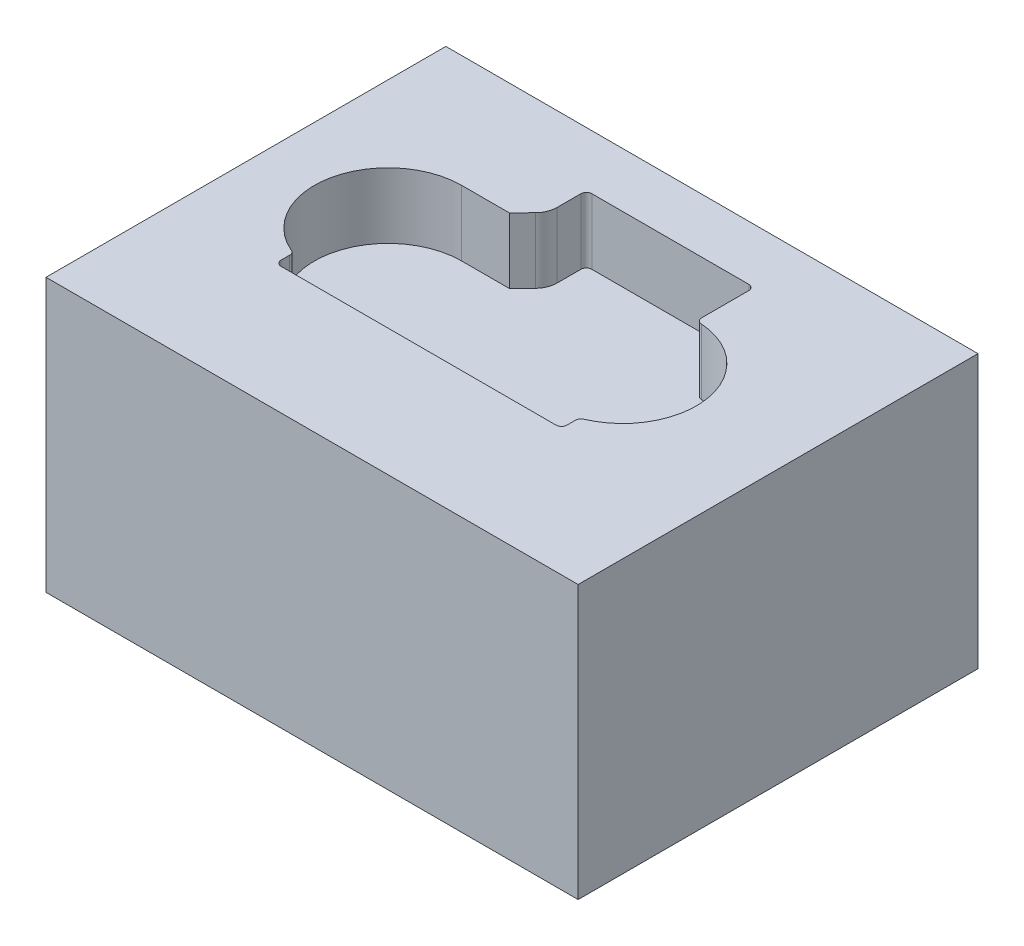
from build123d import *

# Parameters (mm, degrees)
SKETCH1_W           = 290
SKETCH1_H           = 400
BOSS_EXTRUDE1_DEPTH = 35
SKETCH2_W           = 270
SKETCH2_H           = 380
CUT_EXTRUDE2_DEPTH  = 10
CUT_EXTRUDE3_DEPTH  = 6
FILLET2_R           = 2
FILLET4_R           = 0.5
FILLET5_R           = 0.5
FILLET6_R           = 0.5
FILLET7_R           = 0.5
FILLET8_R           = 0.5
FILLET9_R           = 0.5
SKETCH4_W           = 290
SKETCH4_H           = 400
SKETCH4_W_2         = 48.749470761
SKETCH4_H_2         = 36.632728687
CUT_EXTRUDE4_DEPTH  = 250.499498997


with BuildPart() as part:
    # Sketch1 → Boss-Extrude1 (new body)
    with BuildSketch(Plane(origin=(0, 0, 0), x_dir=(1, 0, 0), z_dir=(0, 1, 0))):
        Rectangle(SKETCH1_W, SKETCH1_H)
    extrude(amount=BOSS_EXTRUDE1_DEPTH)

    # Sketch2 → Cut-Extrude2 (cut)
    with BuildSketch(Plane(origin=(0, 35, 0), x_dir=(1, 0, 0), z_dir=(0, 1, 0))):
        Rectangle(SKETCH2_W, SKETCH2_H)
    extrude(amount=-CUT_EXTRUDE2_DEPTH, mode=Mode.SUBTRACT)

    # Sketch3 → Cut-Extrude3 (cut)
    with BuildSketch(Plane(origin=(0, 25, 0), x_dir=(1, 0, 0), z_dir=(0, 1, 0))):
        with BuildLine():
            Line((-101.75, 185), (-117.13, 185))
            Line((-117.13, 185), (-117.13, 181.5))
            Line((-117.13, 181.5), (-118.879314151, 179.7))
            Line((-118.879314151, 179.7), (-123.25, 179.7))
            ThreePointArc((-123.25, 179.7), (-129.894170377, 174.14058809), (-125.593842998, 166.62))
            Line((-125.593842998, 166.62), (-125.593842998, 165))
            Line((-125.593842998, 165), (-99.406157002, 165))
            Line((-99.406157002, 165), (-99.406157002, 166.62))
            ThreePointArc((-99.406157002, 166.62), (-95.105829623, 174.14058809), (-101.75, 179.7))
            Line((-101.75, 179.7), (-101.75, 185))
        make_face()
    extrude(amount=-CUT_EXTRUDE3_DEPTH, mode=Mode.SUBTRACT)

    # Fillet2
    fillet2_edges = [part.edges().sort_by_distance(p)[0] for p in [
        (-117.13, 22, -181.5),
    ]]
    fillet(fillet2_edges, radius=FILLET2_R)

    # Fillet4
    fillet4_edges = [part.edges().sort_by_distance(p)[0] for p in [
        (-125.593842998, 22, -166.62),
    ]]
    fillet(fillet4_edges, radius=FILLET4_R)

    # Fillet5
    fillet5_edges = [part.edges().sort_by_distance(p)[0] for p in [
        (-99.406157002, 22, -166.62),
    ]]
    fillet(fillet5_edges, radius=FILLET5_R)

    # Fillet6
    fillet6_edges = [part.edges().sort_by_distance(p)[0] for p in [
        (-101.75, 22, -179.7),
    ]]
    fillet(fillet6_edges, radius=FILLET6_R)

    # Fillet7
    fillet7_edges = [part.edges().sort_by_distance(p)[0] for p in [
        (-101.75, 22, -185),
    ]]
    fillet(fillet7_edges, radius=FILLET7_R)

    # Fillet8
    fillet8_edges = [part.edges().sort_by_distance(p)[0] for p in [
        (-117.13, 22, -185),
    ]]
    fillet(fillet8_edges, radius=FILLET8_R)

    # Fillet9
    fillet9_edges = [part.edges().sort_by_distance(p)[0] for p in [
        (-125.593842998, 22, -165),
        (-99.406157002, 22, -165),
    ]]
    fillet(fillet9_edges, radius=FILLET9_R)

    # Sketch4 → Cut-Extrude4 (cut, through all)
    with BuildSketch(Plane(origin=(0, 35, 0), x_dir=(1, 0, 0), z_dir=(0, 1, 0))):
        Rectangle(SKETCH4_W, SKETCH4_H)
        with Locations((-110.62526462, 171.683635657)):
            Rectangle(SKETCH4_W_2, SKETCH4_H_2, mode=Mode.SUBTRACT)
    extrude(amount=-CUT_EXTRUDE4_DEPTH, mode=Mode.SUBTRACT)


solid = part.part
